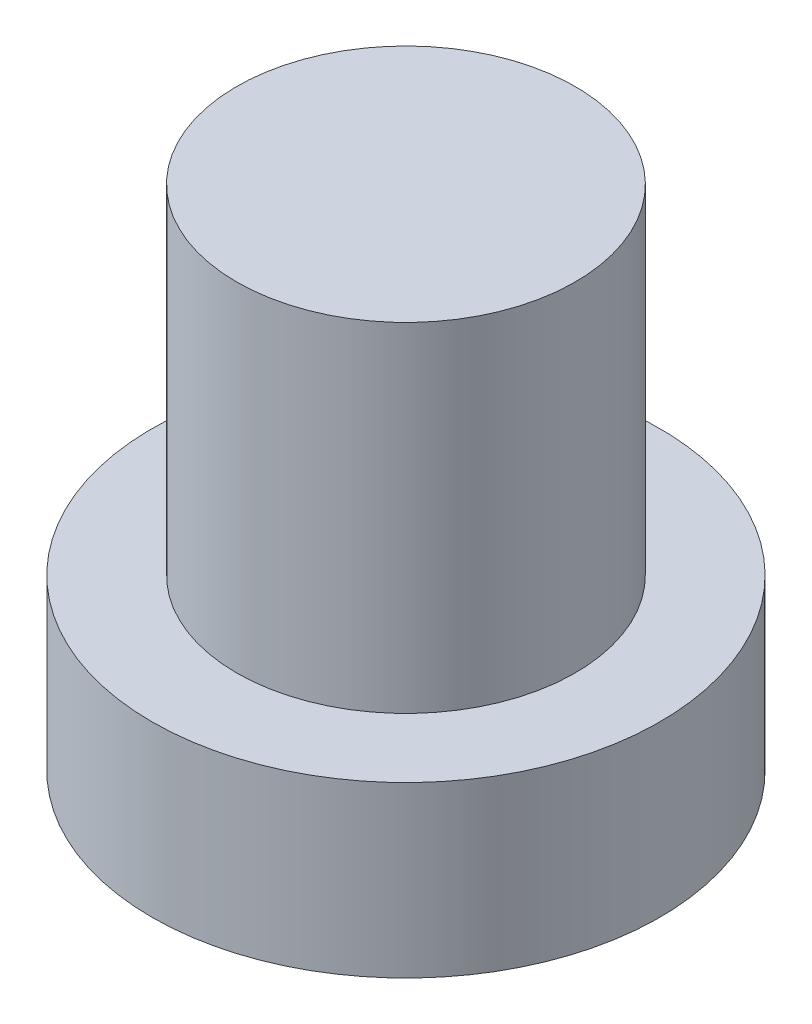
from build123d import *

# Parameters (mm, degrees)
SKETCH_1_R          = 7.5
EXTRUDE_1_DEPTH     = 5
SKETCH_2_R          = 5
EXTRUDE_2_DEPTH     = 10
SKETCH_3_W          = 3.214015664
SKETCH_3_H          = 11.144896912
CUT_EXTRUDE_1_DEPTH = 3


with BuildPart() as part:
    # 草图1 → 凸台-拉伸1 (new body)
    with BuildSketch(Plane(origin=(0, 0, 0), x_dir=(1, 0, 0), z_dir=(0, 1, 0))):
        with Locations(Location((0, 0, 0), (0, 0, 270))):
            Circle(SKETCH_1_R)
    extrude(amount=EXTRUDE_1_DEPTH)

    # 草图2 → 凸台-拉伸2 (add)
    with BuildSketch(Plane(origin=(0, 5, 0), x_dir=(1, 0, 0), z_dir=(0, 1, 0))):
        with Locations(Location((0, 0, 0), (0, 0, 270))):
            Circle(SKETCH_2_R)
    extrude(amount=EXTRUDE_2_DEPTH)

    # 草图3 → 切除-拉伸1 (cut)
    with BuildSketch(Plane(origin=(0, 0, 0), x_dir=(-1, 0, 0), z_dir=(0, -1, 0))):
        Rectangle(SKETCH_3_W, SKETCH_3_H)
    extrude(amount=-CUT_EXTRUDE_1_DEPTH, mode=Mode.SUBTRACT)


solid = part.part
